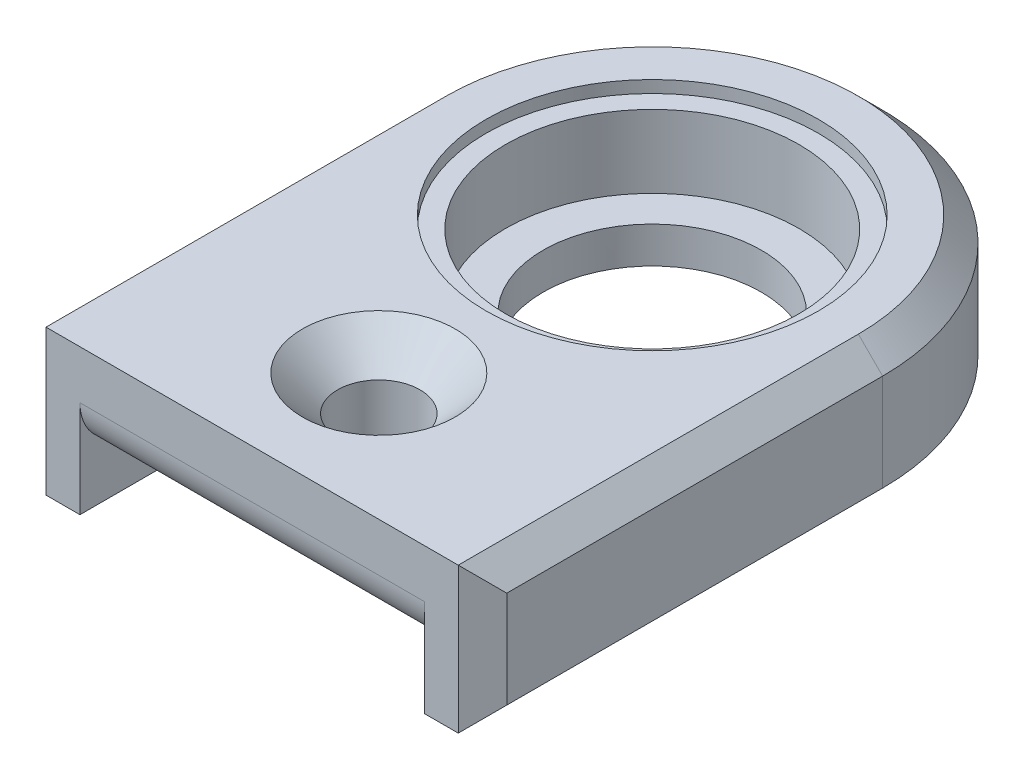
from build123d import *

# Parameters (mm, degrees)
BOSS_EXTRUDE1_DEPTH                                 = 6
CUT_EXTRUDE1_DEPTH                                  = 2
SKETCH3_R                                           = 6.05
CUT_EXTRUDE2_DEPTH                                  = 3.5
SKETCH4_R                                           = 6.85
CUT_EXTRUDE3_DEPTH                                  = 0.5
CUT_EXTRUDE4_REACH                                  = 21.358
SKETCH5_R                                           = 4.5
FILLET1_R                                           = 2
SKETCH6_R                                           = 5
SKETCH6_R_2                                         = 4.5
BOSS_EXTRUDE2_DEPTH                                 = 1
CSK_FOR_M3_COUNTERSUNK_FLAT_HEAD_SCREW1_D           = 3.4
CSK_FOR_M3_COUNTERSUNK_FLAT_HEAD_SCREW1_CSINK_D     = 6.3
CSK_FOR_M3_COUNTERSUNK_FLAT_HEAD_SCREW1_CSINK_ANGLE = 90
CHAMFER1_SIZE                                       = 1


with BuildPart() as part:
    # Sketch2 → Boss-Extrude1 (new body)
    with BuildSketch(Plane(origin=(0, 0, 0), x_dir=(1, 0, 0), z_dir=(0, 1, 0))):
        with BuildLine():
            Line((-9.5, -16.5), (-9.5, 0))
            ThreePointArc((-9.5, 0), (0, 9.5), (9.5, 0))
            Line((9.5, 0), (9.5, -16.5))
            Line((9.5, -16.5), (-9.5, -16.5))
        make_face()
    extrude(amount=BOSS_EXTRUDE1_DEPTH)

    # Sketch1 → Cut-Extrude1 (cut)
    with BuildSketch(Plane(origin=(0, 0, 0), x_dir=(1, 0, 0), z_dir=(0, 1, 0))):
        with BuildLine():
            Line((-7.1, 0), (-7.1, -16.5))
            Line((-7.1, -16.5), (7.1, -16.5))
            Line((7.1, -16.5), (7.1, 0))
            ThreePointArc((7.1, 0), (0, 7.1), (-7.1, 0))
        make_face()
    extrude(amount=CUT_EXTRUDE1_DEPTH, mode=Mode.SUBTRACT)

    # Sketch3 → Cut-Extrude2 (cut)
    with BuildSketch(Plane(origin=(0, 6, 0), x_dir=(1, 0, 0), z_dir=(0, 1, 0))):
        with Locations(Location((0, 0, 0), (0, 0, 270))):
            Circle(SKETCH3_R)
    extrude(amount=-CUT_EXTRUDE2_DEPTH, mode=Mode.SUBTRACT)

    # Sketch4 → Cut-Extrude3 (cut)
    with BuildSketch(Plane(origin=(0, 6, 0), x_dir=(1, 0, 0), z_dir=(0, 1, 0))):
        with Locations(Location((0, 0, 0), (0, 0, 270))):
            Circle(SKETCH4_R)
    extrude(amount=-CUT_EXTRUDE3_DEPTH, mode=Mode.SUBTRACT)

    # Sketch5 → Cut-Extrude4 (cut, up to next)
    with BuildSketch(Plane(origin=(0, 2.5, 0), x_dir=(1, 0, 0), z_dir=(0, 1, 0)), mode=Mode.PRIVATE) as cut_extrude4_sk1:
        with Locations(Location((0, 0, 0), (0, 0, 270))):
            Circle(SKETCH5_R)
    cut_extrude4_tool1 = extrude(cut_extrude4_sk1.sketch, amount=-CUT_EXTRUDE4_REACH, mode=Mode.PRIVATE) & part.part
    add(cut_extrude4_tool1.solids().sort_by_distance((0, 2.5, 0))[0], mode=Mode.SUBTRACT)

    # Fillet1
    fillet1_edges = [part.edges().sort_by_distance(p)[0] for p in [
        (0, 2, 16.5),
    ]]
    fillet(fillet1_edges, radius=FILLET1_R)

    # Sketch6 → Boss-Extrude2 (add)
    with BuildSketch(Plane.XZ.offset(-2)):
        with Locations(Location((0, 0, 0), (0, 0, 90))):
            Circle(SKETCH6_R)
        with Locations(Location((0, 0, 0), (0, 0, 90))):
            Circle(SKETCH6_R_2, mode=Mode.SUBTRACT)
    extrude(amount=BOSS_EXTRUDE2_DEPTH)

    # CSK for M3 Countersunk Flat Head Screw1 (through all)
    with Locations(Plane(origin=(0, 6, 0), x_dir=(1, 0, 0), z_dir=(0, 1, 0))):
        with Locations((0, -11.275)):
            CounterSinkHole(CSK_FOR_M3_COUNTERSUNK_FLAT_HEAD_SCREW1_D / 2, CSK_FOR_M3_COUNTERSUNK_FLAT_HEAD_SCREW1_CSINK_D / 2, counter_sink_angle=CSK_FOR_M3_COUNTERSUNK_FLAT_HEAD_SCREW1_CSINK_ANGLE)

    # Chamfer1
    chamfer1_edges = [part.edges().sort_by_distance(p)[0] for p in [
        (9.5, 6, 8.25),
        (0, 6, -9.5),
        (9.5, 0, 8.25),
        (-9.5, 0, 8.25),
        (0, 0, -9.5),
        (-9.5, 6, 8.25),
        (9.5, 3, 16.5),
        (-9.5, 3, 16.5),
    ]]
    chamfer(chamfer1_edges, length=CHAMFER1_SIZE)


solid = part.part
